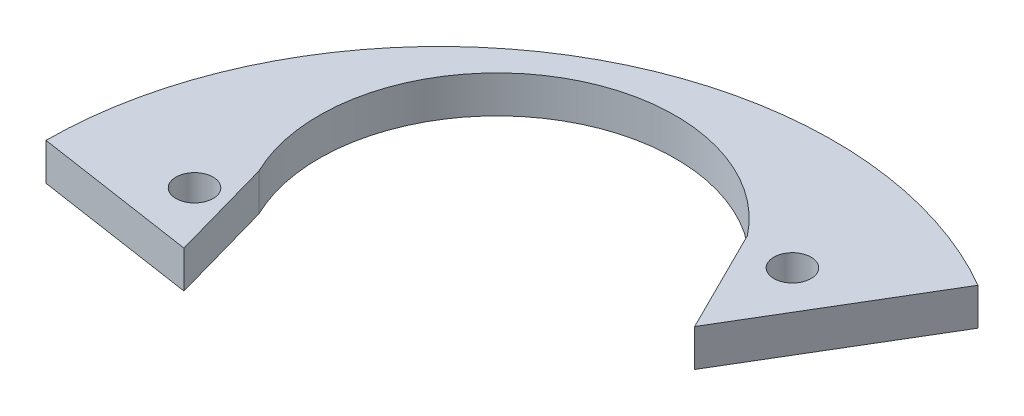
from build123d import *

# Parameters (mm, degrees)
SKETCH1_R           = 1.5
BOSS_EXTRUDE1_DEPTH = 3


with BuildPart() as part:
    # Sketch1 → Boss-Extrude1 (new body)
    with BuildSketch(Plane(origin=(0, 0, 0), x_dir=(1, 0, 0), z_dir=(0, 1, 0))):
        with BuildLine():
            ThreePointArc((-21.904580175, -11.149573826), (-16.613262981, 7.314570744), (2.310408028, 4.025597064))
            Line((2.310408028, 4.025597064), (6.530490254, -4.452553635))
            Line((6.530490254, -4.452553635), (15.07165127, 9.857606543))
            ThreePointArc((15.07165127, 9.857606543), (-16.700482533, 9.891564727), (-32.623744859, -17.602422915))
            Line((-32.623744859, -17.602422915), (-19.537696929, -19.565138538))
            Line((-19.537696929, -19.565138538), (-21.904580175, -11.149573826))
        make_face()
        with Locations(Location((-23.321800839, -14.928602489, 0), (0, 0, 270))):
            Circle(SKETCH1_R, mode=Mode.SUBTRACT)
        with Locations(Location((6.377238608, 3.590767262, 0), (0, 0, 270))):
            Circle(SKETCH1_R, mode=Mode.SUBTRACT)
    extrude(amount=BOSS_EXTRUDE1_DEPTH)


solid = part.part
